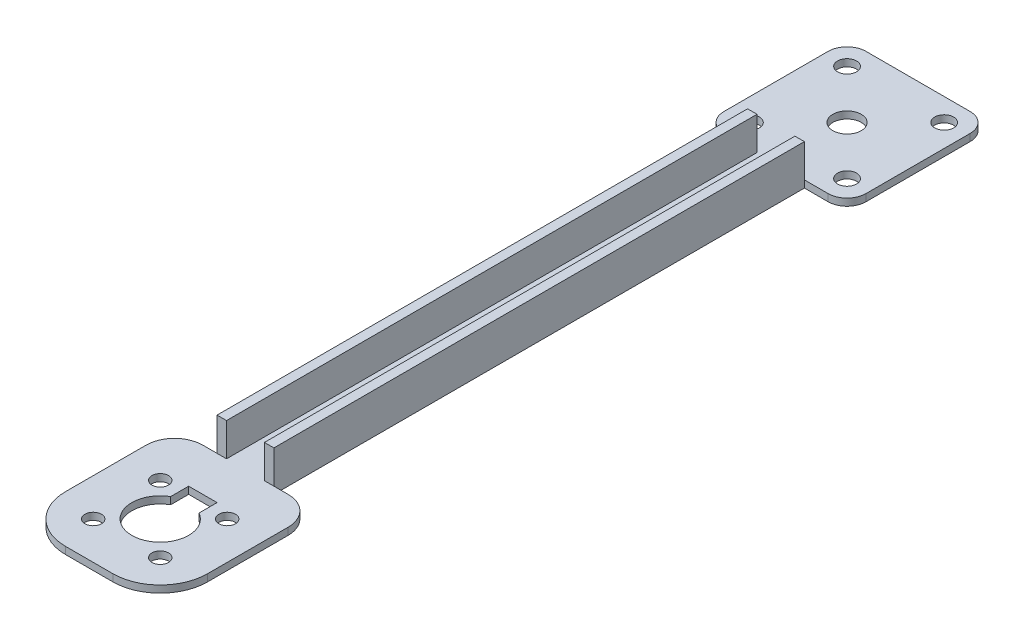
from build123d import *

# Parameters (mm, degrees)
SKETCH_2_W           = 30
SKETCH_2_H           = 31
SKETCH_2_R           = 3
EXTRUDE_1_DEPTH      = 1.5
SKETCH_4_W           = 30
SKETCH_4_H           = 137
SKETCH_4_R           = 1.75
SKETCH_4_R_2         = 6
EXTRUDE_2_DEPTH      = 1.5
SKETCH_5_W           = 6
SKETCH_5_H           = 6
CUT_EXTRUDE_1_DEPTH  = 161.708587201
FILLET_7_R           = 10
CUT_EXTRUDE_2_DEPTH  = 161.708587201
FILLET_10_R          = 6
EXTRUDE_START        = -1.5
SKETCH_7_W           = 30
SKETCH_7_H           = 30
SKETCH_7_R           = 3
SKETCH_7_R_2         = 2
EXTRUDE_3_DEPTH      = 1.5
FILLET_12_R          = 4
EXTRUDE_4_DEPTH      = 7
EXTRUDE_4_DEPTH_BACK = 1.5
SKETCH_8_W           = 2
SKETCH_8_H           = 112


with BuildPart() as part:
    # 草图2 → 凸台-拉伸1 (new body)
    with BuildSketch(Plane(origin=(0, 0, 0), x_dir=(1, 0, 0), z_dir=(0, 1, 0))):
        with Locations((0, -7.5)):
            Rectangle(SKETCH_2_W, SKETCH_2_H)
        with Locations(Location((0, 0, 0), (0, 0, 270))):
            Circle(SKETCH_2_R, mode=Mode.SUBTRACT)
    extrude(amount=EXTRUDE_1_DEPTH)

    # 草图4 → 凸台-拉伸2 (add)
    with BuildSketch(Plane(origin=(0, 1.5, 0), x_dir=(1, 0, 0), z_dir=(0, 1, 0))):
        with Locations((0, -91.5)):
            Rectangle(SKETCH_4_W, SKETCH_4_H)
        with Locations(Location((7.071067812, -137.928932188, 0), (0, 0, 270))):
            Circle(SKETCH_4_R, mode=Mode.SUBTRACT)
        with Locations(Location((-7.071067812, -152.071067812, 0), (0, 0, 270))):
            Circle(SKETCH_4_R, mode=Mode.SUBTRACT)
        with Locations(Location((-7.071067812, -137.928932188, 0), (0, 0, 270))):
            Circle(SKETCH_4_R, mode=Mode.SUBTRACT)
        with Locations(Location((7.071067812, -152.071067812, 0), (0, 0, 270))):
            Circle(SKETCH_4_R, mode=Mode.SUBTRACT)
        with Locations(Location((0, -145, 0), (0, 0, 270))):
            Circle(SKETCH_4_R_2, mode=Mode.SUBTRACT)
    extrude(amount=-EXTRUDE_2_DEPTH)

    # 草图5 → 切除-拉伸1 (cut, through all)
    with BuildSketch(Plane(origin=(0, 1.5, 0), x_dir=(1, 0, 0), z_dir=(0, 1, 0))):
        with Locations((0, -139)):
            Rectangle(SKETCH_5_W, SKETCH_5_H)
    extrude(amount=-CUT_EXTRUDE_1_DEPTH, mode=Mode.SUBTRACT)

    # 圆角7
    fillet_7_edges = [part.edges().sort_by_distance(p)[0] for p in [
        (-15, 0.75, 160),
        (15, 0.75, 160),
    ]]
    fillet(fillet_7_edges, radius=FILLET_7_R)

    # 草图6 → 切除-拉伸2 (cut, through all)
    with BuildSketch(Plane(origin=(0, 1.5, 0), x_dir=(1, 0, 0), z_dir=(0, 1, 0))):
        Polygon((-8, 8), (-8, -8), (-4, -8), (-4, -127), (-8, -127), (-15, -127), (-15, 8), align=None)
        Polygon((15, 8), (8, 8), (8, -8), (4, -8), (4, -127), (8, -127), (15, -127), align=None)
    extrude(amount=-CUT_EXTRUDE_2_DEPTH, mode=Mode.SUBTRACT)

    # 圆角10
    fillet_10_edges = [part.edges().sort_by_distance(p)[0] for p in [
        (-15, 0.75, 127),
        (15, 0.75, 127),
    ]]
    fillet(fillet_10_edges, radius=FILLET_10_R)

    # 草图7 → 凸台-拉伸3 (add)
    with BuildSketch(Plane(origin=(0, 1.5, 0), x_dir=(1, 0, 0), z_dir=(0, 1, 0)).offset(EXTRUDE_START)):
        Rectangle(SKETCH_7_W, SKETCH_7_H)
        with Locations(Location((0, 0, 0), (0, 0, 270))):
            Circle(SKETCH_7_R, mode=Mode.SUBTRACT)
        with Locations(Location((-10.253048327, 10.253048327, 0), (0, 0, 270))):
            Circle(SKETCH_7_R_2, mode=Mode.SUBTRACT)
        with Locations(Location((10.253048327, 10.253048327, 0), (0, 0, 270))):
            Circle(SKETCH_7_R_2, mode=Mode.SUBTRACT)
        with Locations(Location((-10.253048327, -10.253048327, 0), (0, 0, 270))):
            Circle(SKETCH_7_R_2, mode=Mode.SUBTRACT)
        with Locations(Location((10.253048327, -10.253048327, 0), (0, 0, 270))):
            Circle(SKETCH_7_R_2, mode=Mode.SUBTRACT)
    extrude(amount=EXTRUDE_3_DEPTH)

    # 圆角12
    fillet_12_edges = [part.edges().sort_by_distance(p)[0] for p in [
        (15, 0.75, 15),
        (15, 0.75, -15),
        (-15, 0.75, 15),
        (-15, 0.75, -15),
    ]]
    fillet(fillet_12_edges, radius=FILLET_12_R)

    # 草图8 → 凸台-拉伸4 (add, two sides: drawn at the far end of the back side and taken through both)
    with BuildSketch(Plane(origin=(0, 1.5, 0), x_dir=(1, 0, 0), z_dir=(0, 1, 0)).offset(-EXTRUDE_4_DEPTH_BACK)):
        with Locations((-5, -71)):
            Rectangle(SKETCH_8_W, SKETCH_8_H)
        with Locations((5, -71)):
            Rectangle(SKETCH_8_W, SKETCH_8_H)
    extrude(amount=EXTRUDE_4_DEPTH + EXTRUDE_4_DEPTH_BACK)


solid = part.part
